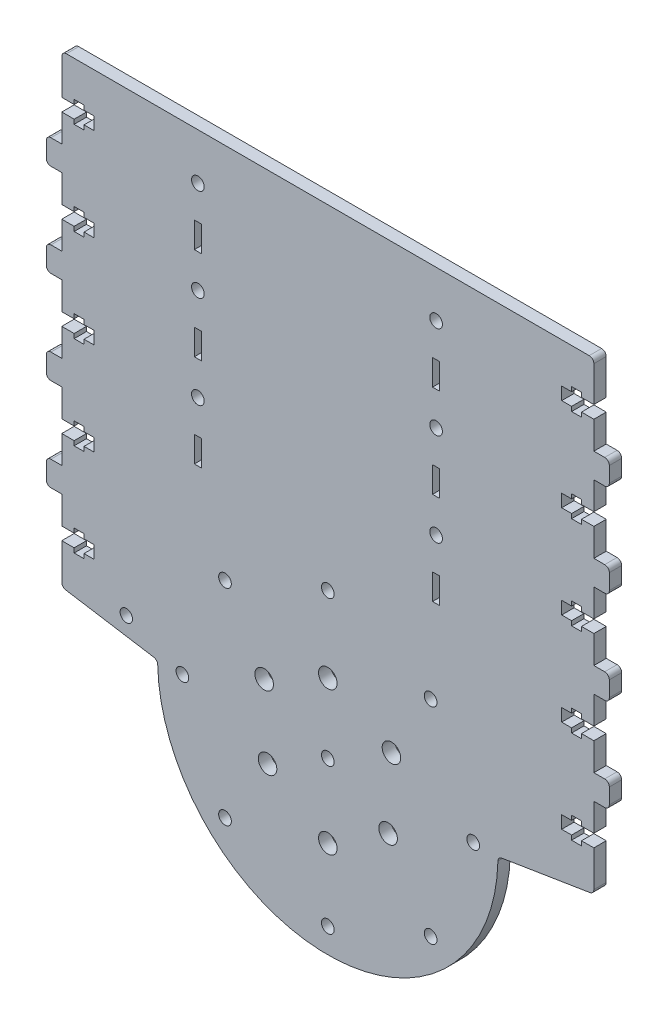
from build123d import *

# Parameters (mm, degrees)
SKETCH_1_R      = 2.05
SKETCH_1_R_2    = 3
SKETCH_1_R_3    = 2
SKETCH_1_W      = 2.3
SKETCH_1_H      = 8.3
EXTRUDE_1_DEPTH = 4
FILLET_1_R      = 1.5


with BuildPart() as part:
    # 草图1 → 凸台-拉伸1 (new body)
    with BuildSketch(Plane.XY):
        with BuildLine():
            Line((143, 45.95), (147, 45.95))
            Line((147, 45.95), (147, 44.5))
            Line((147, 44.5), (150.2, 44.5))
            Line((150.2, 44.5), (150.2, 45.95))
            Line((150.2, 45.95), (153.4, 45.95))
            Line((153.4, 45.95), (153.4, 50.05))
            Line((153.4, 50.05), (150.2, 50.05))
            Line((150.2, 50.05), (150.2, 51.5))
            Line((150.2, 51.5), (147, 51.5))
            Line((147, 51.5), (147, 50.05))
            Line((147, 50.05), (143, 50.05))
            Line((143, 50.05), (143, 59))
            Line((143, 59), (138, 59))
            Line((138, 59), (138, 67))
            Line((138, 67), (143, 67))
            Line((143, 67), (143, 75.95))
            Line((143, 75.95), (147, 75.95))
            Line((147, 75.95), (147, 74.5))
            Line((147, 74.5), (150.2, 74.5))
            Line((150.2, 74.5), (150.2, 75.95))
            Line((150.2, 75.95), (153.4, 75.95))
            Line((153.4, 75.95), (153.4, 80.05))
            Line((153.4, 80.05), (150.2, 80.05))
            Line((150.2, 80.05), (150.2, 81.5))
            Line((150.2, 81.5), (147, 81.5))
            Line((147, 81.5), (147, 80.05))
            Line((147, 80.05), (143, 80.05))
            Line((143, 80.05), (143, 89))
            Line((143, 89), (138, 89))
            Line((138, 89), (138, 97))
            Line((138, 97), (143, 97))
            Line((143, 97), (143, 105.95))
            Line((143, 105.95), (147, 105.95))
            Line((147, 105.95), (147, 104.5))
            Line((147, 104.5), (150.2, 104.5))
            Line((150.2, 104.5), (150.2, 105.95))
            Line((150.2, 105.95), (153.4, 105.95))
            Line((153.4, 105.95), (153.4, 110.05))
            Line((153.4, 110.05), (150.2, 110.05))
            Line((150.2, 110.05), (150.2, 111.5))
            Line((150.2, 111.5), (147, 111.5))
            Line((147, 111.5), (147, 110.05))
            Line((147, 110.05), (143, 110.05))
            Line((143, 110.05), (143, 119))
            Line((143, 119), (143, 123))
            Line((143, 123), (315, 123))
            Line((315, 123), (315, 119))
            Line((315, 119), (315, 110.05))
            Line((315, 110.05), (311, 110.05))
            Line((311, 110.05), (311, 111.5))
            Line((311, 111.5), (307.8, 111.5))
            Line((307.8, 111.5), (307.8, 110.05))
            Line((307.8, 110.05), (304.6, 110.05))
            Line((304.6, 110.05), (304.6, 105.95))
            Line((304.6, 105.95), (307.8, 105.95))
            Line((307.8, 105.95), (307.8, 104.5))
            Line((307.8, 104.5), (311, 104.5))
            Line((311, 104.5), (311, 105.95))
            Line((311, 105.95), (315, 105.95))
            Line((315, 105.95), (315, 97))
            Line((315, 97), (320, 97))
            Line((320, 97), (320, 89))
            Line((320, 89), (315, 89))
            Line((315, 89), (315, 80.05))
            Line((315, 80.05), (311, 80.05))
            Line((311, 80.05), (311, 81.5))
            Line((311, 81.5), (307.8, 81.5))
            Line((307.8, 81.5), (307.8, 80.05))
            Line((307.8, 80.05), (304.6, 80.05))
            Line((304.6, 80.05), (304.6, 75.95))
            Line((304.6, 75.95), (307.8, 75.95))
            Line((307.8, 75.95), (307.8, 74.5))
            Line((307.8, 74.5), (311, 74.5))
            Line((311, 74.5), (311, 75.95))
            Line((311, 75.95), (315, 75.95))
            Line((315, 75.95), (315, 67))
            Line((315, 67), (320, 67))
            Line((320, 67), (320, 59))
            Line((320, 59), (315, 59))
            Line((315, 59), (315, 50.05))
            Line((315, 50.05), (311, 50.05))
            Line((311, 50.05), (311, 51.5))
            Line((311, 51.5), (307.8, 51.5))
            Line((307.8, 51.5), (307.8, 50.05))
            Line((307.8, 50.05), (304.6, 50.05))
            Line((304.6, 50.05), (304.6, 45.95))
            Line((304.6, 45.95), (307.8, 45.95))
            Line((307.8, 45.95), (307.8, 44.5))
            Line((307.8, 44.5), (311, 44.5))
            Line((311, 44.5), (311, 45.95))
            Line((311, 45.95), (315, 45.95))
            Line((315, 45.95), (315, 37))
            Line((315, 37), (320, 37))
            Line((320, 37), (320, 29))
            Line((320, 29), (315, 29))
            Line((315, 29), (315, 20.05))
            Line((315, 20.05), (311, 20.05))
            Line((311, 20.05), (311, 21.5))
            Line((311, 21.5), (307.8, 21.5))
            Line((307.8, 21.5), (307.8, 20.05))
            Line((307.8, 20.05), (304.6, 20.05))
            Line((304.6, 20.05), (304.6, 15.95))
            Line((304.6, 15.95), (307.8, 15.95))
            Line((307.8, 15.95), (307.8, 14.5))
            Line((307.8, 14.5), (311, 14.5))
            Line((311, 14.5), (311, 15.95))
            Line((311, 15.95), (315, 15.95))
            Line((315, 15.95), (315, 7))
            Line((315, 7), (320, 7))
            Line((320, 7), (320, -1))
            Line((320, -1), (315, -1))
            Line((315, -1), (315, -9.95))
            Line((315, -9.95), (311, -9.95))
            Line((311, -9.95), (311, -8.5))
            Line((311, -8.5), (307.8, -8.5))
            Line((307.8, -8.5), (307.8, -9.95))
            Line((307.8, -9.95), (304.6, -9.95))
            Line((304.6, -9.95), (304.6, -14.05))
            Line((304.6, -14.05), (307.8, -14.05))
            Line((307.8, -14.05), (307.8, -15.5))
            Line((307.8, -15.5), (311, -15.5))
            Line((311, -15.5), (311, -14.05))
            Line((311, -14.05), (315, -14.05))
            Line((315, -14.05), (315, -27))
            Line((315, -27), (284, -32))
            ThreePointArc((284, -32), (229, -87), (174, -32))
            Line((174, -32), (143, -27))
            Line((143, -27), (143, -14.05))
            Line((143, -14.05), (147, -14.05))
            Line((147, -14.05), (147, -15.5))
            Line((147, -15.5), (150.2, -15.5))
            Line((150.2, -15.5), (150.2, -14.05))
            Line((150.2, -14.05), (153.4, -14.05))
            Line((153.4, -14.05), (153.4, -9.95))
            Line((153.4, -9.95), (150.2, -9.95))
            Line((150.2, -9.95), (150.2, -8.5))
            Line((150.2, -8.5), (147, -8.5))
            Line((147, -8.5), (147, -9.95))
            Line((147, -9.95), (143, -9.95))
            Line((143, -9.95), (143, -1))
            Line((143, -1), (138, -1))
            Line((138, -1), (138, 7))
            Line((138, 7), (143, 7))
            Line((143, 7), (143, 15.95))
            Line((143, 15.95), (147, 15.95))
            Line((147, 15.95), (147, 14.5))
            Line((147, 14.5), (150.2, 14.5))
            Line((150.2, 14.5), (150.2, 15.95))
            Line((150.2, 15.95), (153.4, 15.95))
            Line((153.4, 15.95), (153.4, 20.05))
            Line((153.4, 20.05), (150.2, 20.05))
            Line((150.2, 20.05), (150.2, 21.5))
            Line((150.2, 21.5), (147, 21.5))
            Line((147, 21.5), (147, 20.05))
            Line((147, 20.05), (143, 20.05))
            Line((143, 20.05), (143, 29))
            Line((143, 29), (138, 29))
            Line((138, 29), (138, 37))
            Line((138, 37), (143, 37))
            Line((143, 37), (143, 45.95))
        make_face()
        with Locations((187, 108)):
            Circle(SKETCH_1_R, mode=Mode.SUBTRACT)
        with Locations((229, -55.75)):
            Circle(SKETCH_1_R_2, mode=Mode.SUBTRACT)
        with Locations((248.485571585, -43.25)):
            Circle(SKETCH_1_R_2, mode=Mode.SUBTRACT)
        with Locations((229, -32)):
            Circle(SKETCH_1_R, mode=Mode.SUBTRACT)
        with Locations((276, -32)):
            Circle(SKETCH_1_R, mode=Mode.SUBTRACT)
        with Locations((208.43189666, -20.125)):
            Circle(SKETCH_1_R_2, mode=Mode.SUBTRACT)
        with Locations((249.56810334, -20.125)):
            Circle(SKETCH_1_R_2, mode=Mode.SUBTRACT)
        with Locations((209.514428415, -43.25)):
            Circle(SKETCH_1_R_2, mode=Mode.SUBTRACT)
        with Locations((229, -9.5)):
            Circle(SKETCH_1_R_2, mode=Mode.SUBTRACT)
        with Locations((187, 78)):
            Circle(SKETCH_1_R, mode=Mode.SUBTRACT)
        with Locations((187, 48)):
            Circle(SKETCH_1_R, mode=Mode.SUBTRACT)
        with Locations((262.234018716, -65.234018716)):
            Circle(SKETCH_1_R, mode=Mode.SUBTRACT)
        with Locations((229, -79)):
            Circle(SKETCH_1_R, mode=Mode.SUBTRACT)
        with Locations((195.765981284, -65.234018716)):
            Circle(SKETCH_1_R, mode=Mode.SUBTRACT)
        with Locations((182, -32)):
            Circle(SKETCH_1_R, mode=Mode.SUBTRACT)
        with Locations((195.765981284, 1.234018716)):
            Circle(SKETCH_1_R, mode=Mode.SUBTRACT)
        with Locations((229, 15)):
            Circle(SKETCH_1_R, mode=Mode.SUBTRACT)
        with Locations((262.234018716, 1.234018716)):
            Circle(SKETCH_1_R, mode=Mode.SUBTRACT)
        with Locations((163.858283099, -24.571784035)):
            Circle(SKETCH_1_R_3, mode=Mode.SUBTRACT)
        with Locations((264, 108)):
            Circle(SKETCH_1_R, mode=Mode.SUBTRACT)
        with Locations((264, 78)):
            Circle(SKETCH_1_R, mode=Mode.SUBTRACT)
        with Locations((264, 48)):
            Circle(SKETCH_1_R, mode=Mode.SUBTRACT)
        with Locations((187, 93)):
            Rectangle(SKETCH_1_W, SKETCH_1_H, mode=Mode.SUBTRACT)
        with Locations((187, 63)):
            Rectangle(SKETCH_1_W, SKETCH_1_H, mode=Mode.SUBTRACT)
        with Locations((187, 33)):
            Rectangle(SKETCH_1_W, SKETCH_1_H, mode=Mode.SUBTRACT)
        with Locations((264, 93)):
            Rectangle(SKETCH_1_W, SKETCH_1_H, mode=Mode.SUBTRACT)
        with Locations((264, 63)):
            Rectangle(SKETCH_1_W, SKETCH_1_H, mode=Mode.SUBTRACT)
        with Locations((264, 33)):
            Rectangle(SKETCH_1_W, SKETCH_1_H, mode=Mode.SUBTRACT)
    extrude(amount=EXTRUDE_1_DEPTH)

    # 圆角1
    fillet_1_edges = [part.edges().sort_by_distance(p)[0] for p in [
        (143, -27, 2),
        (138, -1, 2),
        (138, 7, 2),
        (138, 29, 2),
        (138, 37, 2),
        (138, 59, 2),
        (138, 67, 2),
        (138, 89, 2),
        (138, 97, 2),
        (143, 123, 2),
        (315, 123, 2),
        (320, 97, 2),
        (320, 89, 2),
        (320, 67, 2),
        (320, 59, 2),
        (320, 37, 2),
        (320, 29, 2),
        (320, 7, 2),
        (320, -1, 2),
        (315, -27, 2),
        (284, -32, 2),
        (174, -32, 2),
    ]]
    fillet(fillet_1_edges, radius=FILLET_1_R)


solid = part.part
